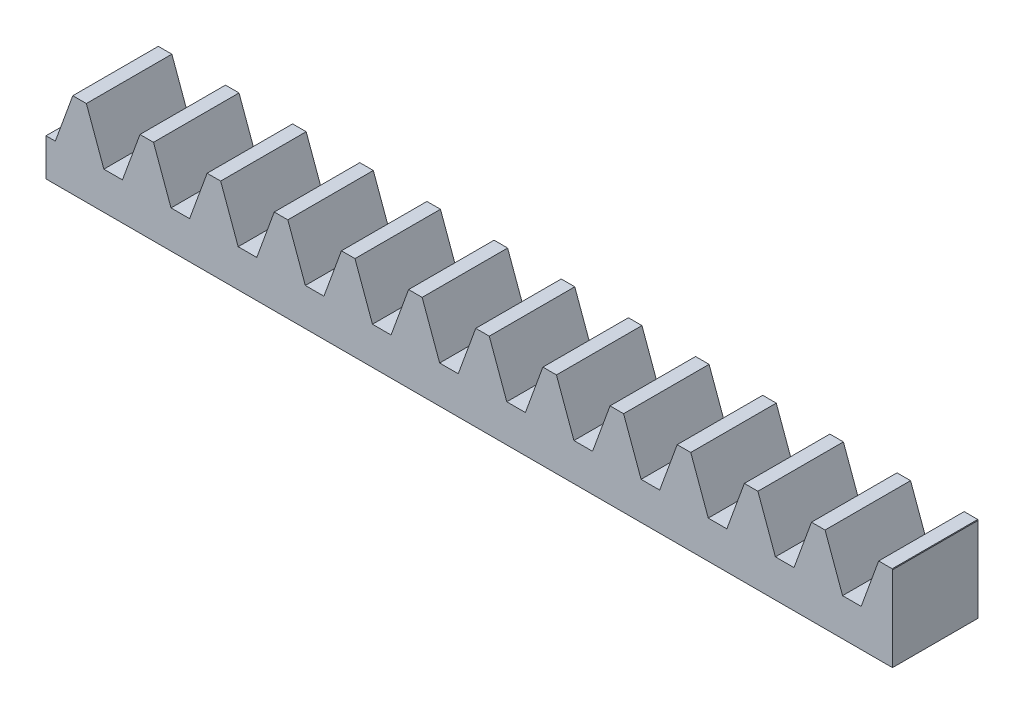
from build123d import *

# Parameters (mm, degrees)
BLANKSKE_W        = 99
BLANKSKE_H        = 10
BLANK_DEPTH       = 10
TOOTHCUTSIM_DEPTH = 101.004999875
TEETHCUTS_COUNT   = 14
TEETHCUTS_PITCH   = 7.853981625


with BuildPart() as part:
    # BlankSke → Blank (new body)
    with BuildSketch(Plane.XY):
        with Locations((49.5, 5)):
            Rectangle(BLANKSKE_W, BLANKSKE_H)
    extrude(amount=-BLANK_DEPTH)

    # TooCutSkeSim → ToothCutSim (cut, through all)
    with BuildSketch(Plane.XY):
        Polygon((1.087088424, 4.375), (-1.087088424, 4.375), (-3.143665836, 10.0254), (3.143665836, 10.0254), align=None)
    toothcutsim = extrude(amount=-TOOTHCUTSIM_DEPTH, mode=Mode.SUBTRACT)

    # TeethCuts: ToothCutSim ×14
    with Locations(*[(i * TEETHCUTS_PITCH, 0, 0) for i in range(1, TEETHCUTS_COUNT)]):
        add(toothcutsim, mode=Mode.SUBTRACT)


solid = part.part
